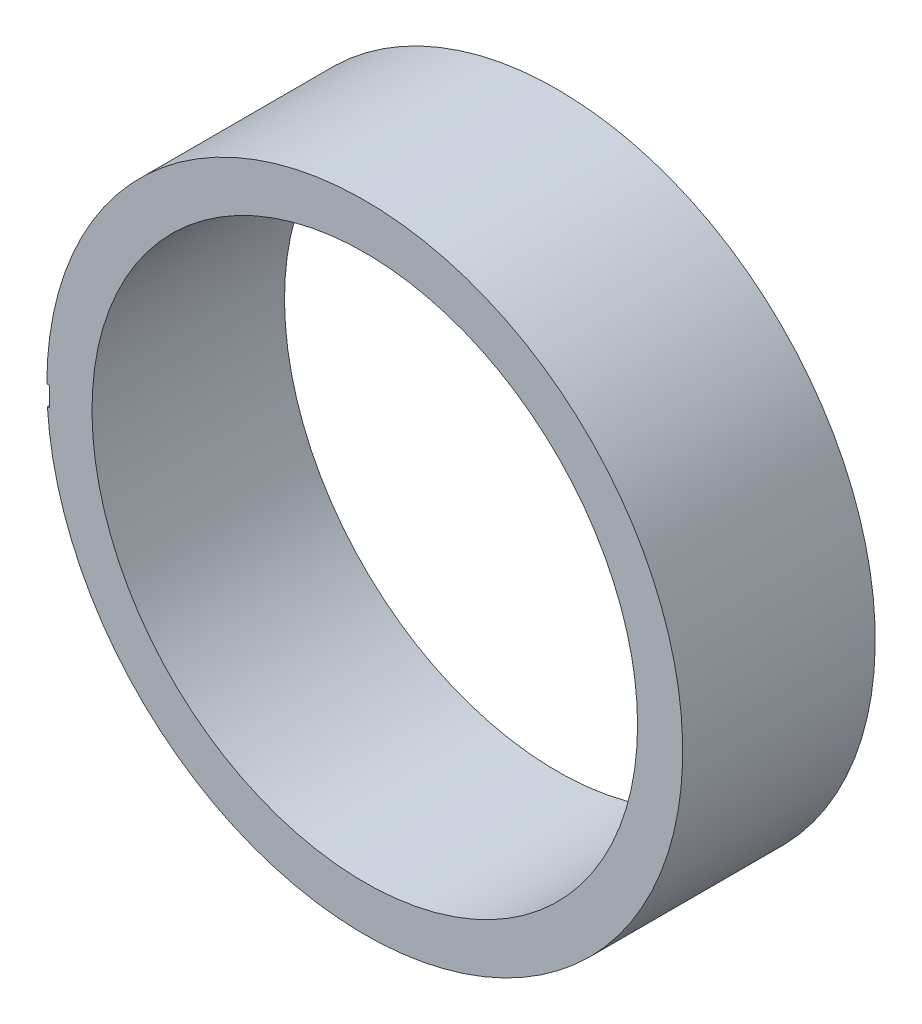
from build123d import *

# Parameters (mm, degrees)
SKETCH1_R           = 16.514885265
SKETCH1_R_2         = 14.17
BOSS_EXTRUDE1_DEPTH = 10
SKETCH2_W           = 1.74827772
SKETCH2_H           = 14.423291192
CUT_EXTRUDE1_DEPTH  = 1
SKETCH3_W           = 1.31818545
SKETCH3_H           = 5.3419597
CUT_EXTRUDE2_DEPTH  = 0.01


with BuildPart() as part:
    # Sketch1 → Boss-Extrude1 (new body)
    with BuildSketch(Plane.XY):
        Circle(SKETCH1_R)
        Circle(SKETCH1_R_2, mode=Mode.SUBTRACT)
    extrude(amount=BOSS_EXTRUDE1_DEPTH)

    # Sketch2 → Cut-Extrude1 (cut)
    with BuildSketch(Plane(origin=(0, 0, 0), x_dir=(1, 0, 0), z_dir=(0, 1, 0))):
        with Locations((-17.239960851, -5.63132251)):
            Rectangle(SKETCH2_W, SKETCH2_H)
    extrude(amount=-CUT_EXTRUDE1_DEPTH, mode=Mode.SUBTRACT)

    # Sketch3 → Cut-Extrude2 (cut)
    with BuildSketch(Plane.XY):
        with Locations((0.974918477, 15.020333746)):
            Rectangle(SKETCH3_W, SKETCH3_H)
    extrude(amount=CUT_EXTRUDE2_DEPTH, mode=Mode.SUBTRACT)


solid = part.part
